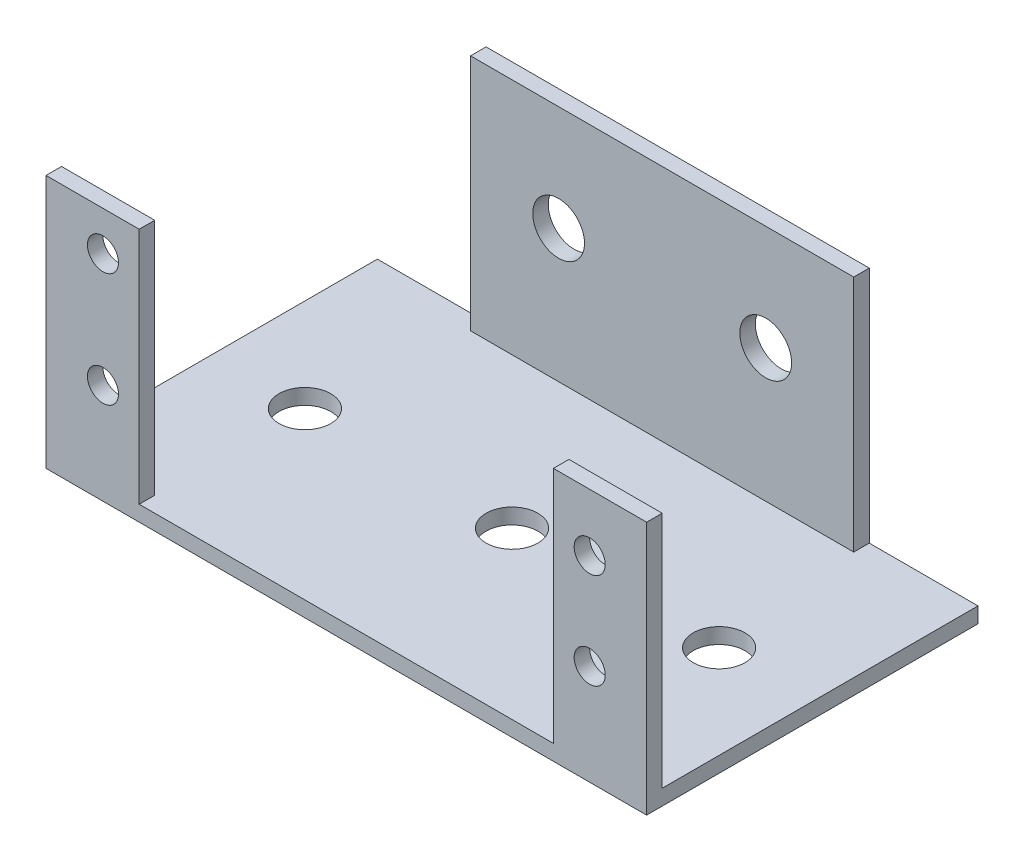
from build123d import *

# Parameters (mm, degrees)
SKETCH1_W           = 58
SKETCH1_H           = 32
BOSS_EXTRUDE1_DEPTH = 1.5
SKETCH1_3_W         = 9
SKETCH1_3_H         = 1.5
BOSS_EXTRUDE2_DEPTH = 23
SKETCH2_R           = 1.5
CUT_EXTRUDE1_DEPTH  = 49.928519291
SKETCH1_4_W         = 37
SKETCH1_4_H         = 1.5
BOSS_EXTRUDE3_DEPTH = 23
SKETCH3_R           = 2.5
CUT_EXTRUDE2_DEPTH  = 48.960921592
SKETCH1_5_R         = 2.5
CUT_EXTRUDE3_DEPTH  = 25


with BuildPart() as part:
    # Sketch1 → Boss-Extrude1 (new body)
    with BuildSketch(Plane(origin=(0, 0, 0), x_dir=(1, 0, 0), z_dir=(0, 1, 0))):
        Rectangle(SKETCH1_W, SKETCH1_H)
    extrude(amount=-BOSS_EXTRUDE1_DEPTH)

    # Sketch1<3> → Boss-Extrude2 (add)
    with BuildSketch(Plane(origin=(0, 0, 0), x_dir=(1, 0, 0), z_dir=(0, 1, 0))):
        with Locations((-24.5, -15.25)):
            Rectangle(SKETCH1_3_W, SKETCH1_3_H)
        with Locations((24.5, -15.25)):
            Rectangle(SKETCH1_3_W, SKETCH1_3_H)
    extrude(amount=BOSS_EXTRUDE2_DEPTH)

    # Sketch2 → Cut-Extrude1 (cut, through all)
    with BuildSketch(Plane.XY.offset(16)):
        with Locations((-23.5, 19.197487824)):
            Circle(SKETCH2_R)
        with Locations((-23.5, 8.197487824)):
            Circle(SKETCH2_R)
        with Locations((23.5, 17.446590768)):
            Circle(SKETCH2_R)
        with Locations((23.5, 8.197487824)):
            Circle(SKETCH2_R)
    extrude(amount=-CUT_EXTRUDE1_DEPTH, mode=Mode.SUBTRACT)

    # Sketch1<4> → Boss-Extrude3 (add)
    with BuildSketch(Plane(origin=(0, 0, 0), x_dir=(1, 0, 0), z_dir=(0, 1, 0))):
        with Locations((0, 15.25)):
            Rectangle(SKETCH1_4_W, SKETCH1_4_H)
    extrude(amount=BOSS_EXTRUDE3_DEPTH)

    # Sketch3 → Cut-Extrude2 (cut, through all)
    with BuildSketch(Plane.XY.offset(-14.5)):
        with Locations((10, 12.822039296)):
            Circle(SKETCH3_R)
        with Locations((-10, 12.822039296)):
            Circle(SKETCH3_R)
    extrude(amount=-CUT_EXTRUDE2_DEPTH, mode=Mode.SUBTRACT)

    # Sketch1<5> → Cut-Extrude3 (cut)
    with BuildSketch(Plane(origin=(0, 0, 0), x_dir=(1, 0, 0), z_dir=(0, 1, 0))):
        with Locations((-20, 0)):
            Circle(SKETCH1_5_R)
        with Locations((20, 0)):
            Circle(SKETCH1_5_R)
        Circle(SKETCH1_5_R)
    extrude(amount=-CUT_EXTRUDE3_DEPTH, mode=Mode.SUBTRACT)


solid = part.part
